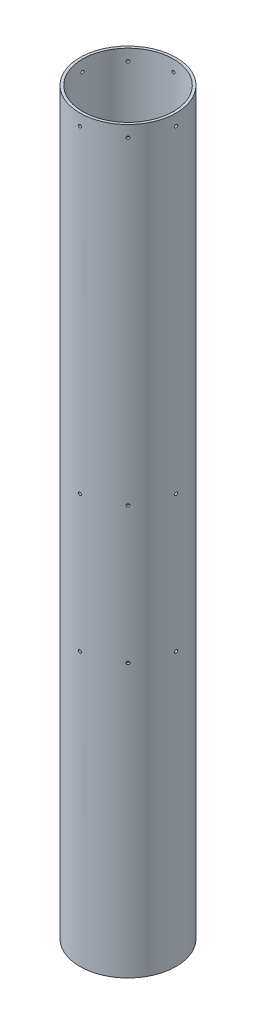
from build123d import *

# Parameters (mm, degrees)
SKETCH1_R                 = 53.721
SKETCH1_R_2               = 50.8
TUBE_EXTRUSION_DEPTH      = 825.5
BULKHEAD_HOLES_REACH      = 836.194
BULKHEAD_HOLES_END_RADIUS = 50.8
SKETCH3_R                 = 1.6383
CIRPATTERN1_COUNT         = 8


with BuildPart() as part:
    # Sketch1 → Tube Extrusion (new body)
    with BuildSketch(Plane(origin=(0, 0, 0), x_dir=(1, 0, 0), z_dir=(0, 1, 0))):
        Circle(SKETCH1_R)
        Circle(SKETCH1_R_2, mode=Mode.SUBTRACT)
    extrude(amount=TUBE_EXTRUSION_DEPTH)

    # Bulkhead Holes: up to this cylinder (the profile starts outside it)
    bulkhead_holes_end = Plane(origin=(0, 558.8, 0), z_dir=(0, -1, 0)) * Cylinder(BULKHEAD_HOLES_END_RADIUS, 2282.988, mode=Mode.PRIVATE)
    # Sketch3 → Bulkhead Holes (cut, up to the surface)
    with BuildSketch(Plane.XY.offset(53.721), mode=Mode.PRIVATE) as bulkhead_holes_sk1:
        with Locations((0, 457.2)):
            Circle(SKETCH3_R)
    bulkhead_holes_tool1 = extrude(bulkhead_holes_sk1.sketch, amount=-BULKHEAD_HOLES_REACH, mode=Mode.PRIVATE) - bulkhead_holes_end
    # Sketch3 → Bulkhead Holes (cut, up to the surface)
    with BuildSketch(Plane.XY.offset(53.721), mode=Mode.PRIVATE) as bulkhead_holes_sk2:
        with Locations((0, 304.8)):
            Circle(SKETCH3_R)
    bulkhead_holes_tool2 = extrude(bulkhead_holes_sk2.sketch, amount=-BULKHEAD_HOLES_REACH, mode=Mode.PRIVATE) - bulkhead_holes_end
    # Sketch3 → Bulkhead Holes (cut, up to the surface)
    with BuildSketch(Plane.XY.offset(53.721), mode=Mode.PRIVATE) as bulkhead_holes_sk3:
        with Locations((0, 812.8)):
            Circle(SKETCH3_R)
    bulkhead_holes_tool3 = extrude(bulkhead_holes_sk3.sketch, amount=-BULKHEAD_HOLES_REACH, mode=Mode.PRIVATE) - bulkhead_holes_end
    bulkhead_holes = bulkhead_holes_tool1.solids().sort_by_distance((0, 457.2, 53.721))[0] + bulkhead_holes_tool2.solids().sort_by_distance((0, 304.8, 53.721))[0] + bulkhead_holes_tool3.solids().sort_by_distance((0, 812.8, 53.721))[0]
    add(bulkhead_holes, mode=Mode.SUBTRACT)

    # CirPattern1: Bulkhead Holes ×8 about axis
    cirpattern1_axis = Axis((0, 825.5, 0), (0, -1, 0))
    for i in range(1, CIRPATTERN1_COUNT):
        add(bulkhead_holes.rotate(cirpattern1_axis, i * 360 / CIRPATTERN1_COUNT), mode=Mode.SUBTRACT)


solid = part.part
